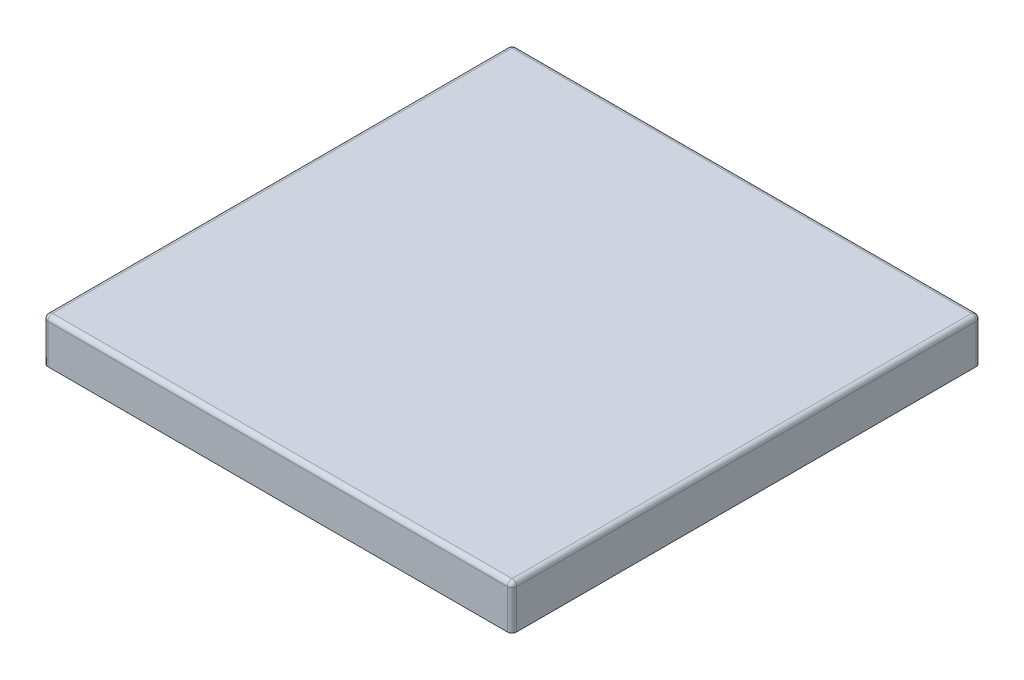
from build123d import *

# Parameters (mm, degrees)
SKETCH1_W                       = 101.6
SKETCH1_H                       = 101.6
BOSS_EXTRUDE1_DEPTH             = 9.525
TAP_DRILL_FOR_6_32_TAP1_D       = 2.7051
TAP_DRILL_FOR_6_32_TAP1_DEPTH   = 6.18730597
TAP_DRILL_FOR_6_32_TAP1_TIP     = 0.81269403
TAP_DRILL_FOR_1_4_20_TAP1_D     = 5.1054
TAP_DRILL_FOR_1_4_20_TAP1_DEPTH = 5.466183098
TAP_DRILL_FOR_1_4_20_TAP1_TIP   = 1.533816902
FILLET1_R                       = 1


with BuildPart() as part:
    # Sketch1 → Boss-Extrude1 (new body)
    with BuildSketch(Plane(origin=(0, 0, 0), x_dir=(1, 0, 0), z_dir=(0, 1, 0))):
        Rectangle(SKETCH1_W, SKETCH1_H)
    extrude(amount=BOSS_EXTRUDE1_DEPTH)

    # Tap Drill for #6-32 Tap1
    with Locations(Plane(origin=(0, 0, 0), x_dir=(-1, 0, 0), z_dir=(0, -1, 0))):
        with Locations((-44.45, -44.45), (-44.45, 44.45), (44.45, 44.45), (44.45, -44.45), (-44.45, -28.575), (-44.45, 28.575), (44.45, 28.575), (44.45, -28.575)):
            Hole(TAP_DRILL_FOR_6_32_TAP1_D / 2, depth=TAP_DRILL_FOR_6_32_TAP1_DEPTH)
            with Locations((0, 0, -(TAP_DRILL_FOR_6_32_TAP1_DEPTH + TAP_DRILL_FOR_6_32_TAP1_TIP / 2))):  # 118° drill point
                Cone(0, TAP_DRILL_FOR_6_32_TAP1_D / 2, TAP_DRILL_FOR_6_32_TAP1_TIP, mode=Mode.SUBTRACT)

    # Tap Drill for 1/4-20 Tap1
    with Locations(Plane(origin=(0, 0, 0), x_dir=(-1, 0, 0), z_dir=(0, -1, 0))):
        with Locations((0, -42.865), (0, 42.865)):
            Hole(TAP_DRILL_FOR_1_4_20_TAP1_D / 2, depth=TAP_DRILL_FOR_1_4_20_TAP1_DEPTH)
            with Locations((0, 0, -(TAP_DRILL_FOR_1_4_20_TAP1_DEPTH + TAP_DRILL_FOR_1_4_20_TAP1_TIP / 2))):  # 118° drill point
                Cone(0, TAP_DRILL_FOR_1_4_20_TAP1_D / 2, TAP_DRILL_FOR_1_4_20_TAP1_TIP, mode=Mode.SUBTRACT)

    # Fillet1
    fillet1_edges = [part.edges().sort_by_distance(p)[0] for p in [
        (50.8, 9.525, 0),
        (0, 9.525, -50.8),
        (-50.8, 9.525, 0),
        (-50.8, 4.7625, -50.8),
        (50.8, 4.7625, -50.8),
        (50.8, 4.7625, 50.8),
        (-50.8, 4.7625, 50.8),
        (0, 9.525, 50.8),
    ]]
    fillet(fillet1_edges, radius=FILLET1_R)


solid = part.part
